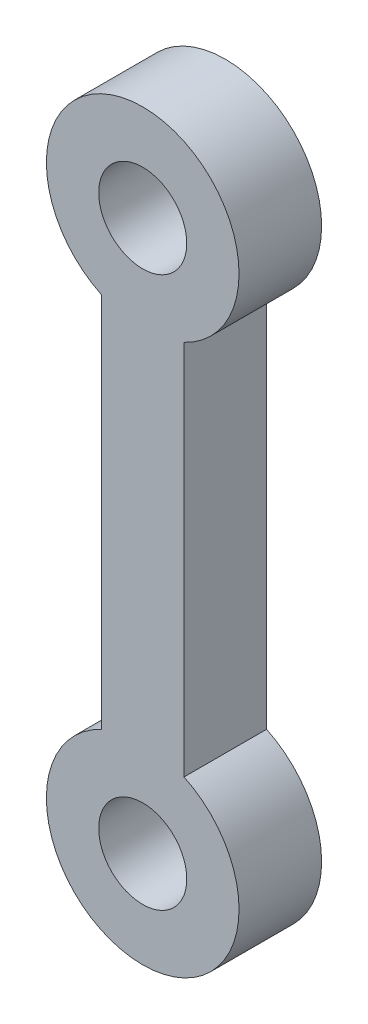
from build123d import *

# Parameters (mm, degrees)
BOSS_EXTRUDE1_DEPTH = 3
SKETCH2_R           = 1.6
CUT_EXTRUDE1_DEPTH  = 3


with BuildPart() as part:
    # Sketch1 → Boss-Extrude1 (new body)
    with BuildSketch(Plane.XY):
        with BuildLine():
            Line((-1.5, -3.16227766), (-1.5, 0))
            Line((-1.5, 0), (1.5, 0))
            Line((1.5, 0), (1.5, -3.16227766))
            ThreePointArc((1.5, -3.16227766), (2.958039892, -1.870828693), (3.5, 0))
            ThreePointArc((3.5, 0), (-1.870828693, 2.958039892), (-1.5, -3.16227766))
        make_face()
        with BuildLine():
            Line((1.5, 0), (-1.5, 0))
            Line((-1.5, 0), (-1.5, -3.16227766))
            ThreePointArc((-1.5, -3.16227766), (0, -3.5), (1.5, -3.16227766))
            Line((1.5, -3.16227766), (1.5, 0))
        make_face()
        with BuildLine():
            ThreePointArc((1.5, -3.16227766), (0, -3.5), (-1.5, -3.16227766))
            Line((-1.5, -3.16227766), (-1.5, -16.83772234))
            ThreePointArc((-1.5, -16.83772234), (0, -16.5), (1.5, -16.83772234))
            Line((1.5, -16.83772234), (1.5, -3.16227766))
        make_face()
        with BuildLine():
            ThreePointArc((1.5, -16.83772234), (0, -16.5), (-1.5, -16.83772234))
            Line((-1.5, -16.83772234), (-1.5, -20))
            Line((-1.5, -20), (1.5, -20))
            Line((1.5, -20), (1.5, -16.83772234))
        make_face()
        with BuildLine():
            Line((-1.5, -20), (-1.5, -16.83772234))
            ThreePointArc((-1.5, -16.83772234), (-1.870828693, -22.958039892), (3.5, -20))
            ThreePointArc((3.5, -20), (2.958039892, -18.129171307), (1.5, -16.83772234))
            Line((1.5, -16.83772234), (1.5, -20))
            Line((1.5, -20), (-1.5, -20))
        make_face()
    extrude(amount=BOSS_EXTRUDE1_DEPTH)

    # Sketch2 → Cut-Extrude1 (cut)
    with BuildSketch(Plane.XY.offset(3)):
        with Locations((0, -20)):
            Circle(SKETCH2_R)
        Circle(SKETCH2_R)
    extrude(amount=-CUT_EXTRUDE1_DEPTH, mode=Mode.SUBTRACT)


solid = part.part
